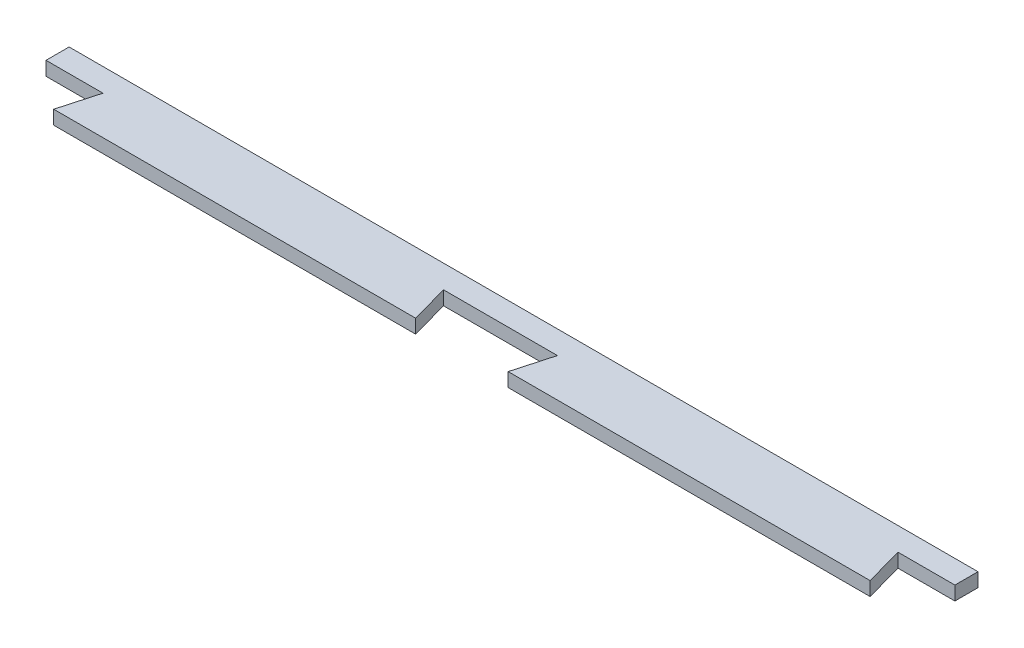
from build123d import *

# Parameters (mm, degrees)
BOSS_EXTRUDE1_DEPTH = 9


with BuildPart() as part:
    # Sketch1 → Boss-Extrude1 (new body)
    with BuildSketch(Plane(origin=(0, 0, 0), x_dir=(1, 0, 0), z_dir=(0, 1, 0))):
        Polygon((0, 25), (37, 25), (30, 0), (265, 0), (258, 25), (332, 25), (325, 0), (560, 0), (553, 25), (590, 25), (590, 40), (0, 40), align=None)
    extrude(amount=BOSS_EXTRUDE1_DEPTH)


solid = part.part
